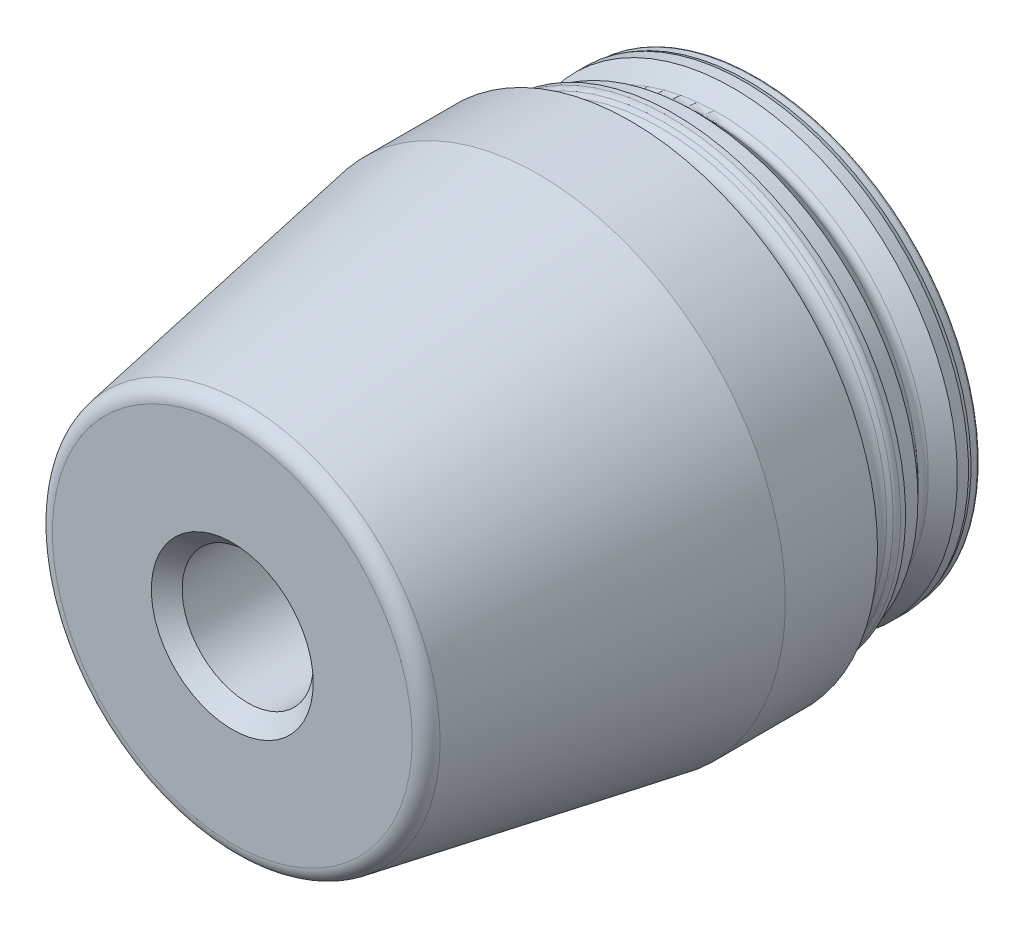
from build123d import *

# Parameters (mm, degrees)
F_5_8_11_TAPPED_HOLE1_D           = 13.49248
F_5_8_11_TAPPED_HOLE1_DEPTH       = 40.1193
F_5_8_11_TAPPED_HOLE1_CSINK_D     = 16.6624
F_5_8_11_TAPPED_HOLE1_CSINK_ANGLE = 90
F_5_8_11_TAPPED_HOLE1_TIP         = 4.053549943
FCH_00_CHAMFER_0_015_SIZE         = 0.381
FILLET1_R                         = 1.5875


with BuildPart() as part:
    # Sketch3 → FBR-00 Basic blank revolve. (revolve)
    with BuildSketch(Plane(origin=(0, 0, 0), x_dir=(0, 0, -1), z_dir=(1, 0, 0)), mode=Mode.PRIVATE) as fbr_00_basic_blank_revolve_sk:
        with BuildLine():
            Line((-45.466, 19.84375), (-45.466, 0))
            Line((-45.466, 0), (-12.115698454, 0))
            Line((-12.115698454, 0), (-7.366, 19.05))
            Line((-7.366, 19.05), (8.509, 19.05))
            Line((8.509, 19.05), (8.509, 22.6695))
            ThreePointArc((8.509, 22.6695), (8.434605122, 22.849105122), (8.255, 22.9235))
            Line((8.255, 22.9235), (7.62, 22.9235))
            Line((7.62, 22.9235), (7.239, 23.0505))
            Line((7.239, 23.0505), (6.096, 23.0505))
            Line((6.096, 23.0505), (4.602815367, 21.557315367))
            ThreePointArc((4.602815367, 21.557315367), (4.064, 21.334130735), (3.525184633, 21.557315367))
            Line((3.525184633, 21.557315367), (2.032, 23.0505))
            Line((2.032, 23.0505), (0, 23.0505))
            Line((0, 23.0505), (0, 23.8125))
            Line((0, 23.8125), (-0.508, 23.8125))
            ThreePointArc((-0.508, 23.8125), (-0.799604775, 23.754496204), (-1.046815367, 23.589315367))
            Line((-1.046815367, 23.589315367), (-1.387974388, 23.248156347))
            ThreePointArc((-1.387974388, 23.248156347), (-2.451768264, 22.887046985), (-3.385852263, 23.511181959))
            Line((-3.385852263, 23.511181959), (-4.476361867, 25.4))
            Line((-4.476361867, 25.4), (-13.95494039, 25.4))
            Line((-13.95494039, 25.4), (-45.466, 19.84375))
        make_face()
    revolve(fbr_00_basic_blank_revolve_sk.sketch.rotate(Axis((0, 0, -27.766671499), (0, 0, 1)), 90), axis=Axis((0, 0, -27.766671499), (0, 0, 1)))

    # 5/8-11 Tapped Hole1
    with Locations(Plane.XY.offset(45.466)):
        with Locations((0, 0)):
            CounterSinkHole(F_5_8_11_TAPPED_HOLE1_D / 2, F_5_8_11_TAPPED_HOLE1_CSINK_D / 2, depth=F_5_8_11_TAPPED_HOLE1_DEPTH, counter_sink_angle=F_5_8_11_TAPPED_HOLE1_CSINK_ANGLE)
            with Locations((0, 0, -(F_5_8_11_TAPPED_HOLE1_DEPTH + F_5_8_11_TAPPED_HOLE1_TIP / 2))):  # 118° drill point
                Cone(0, F_5_8_11_TAPPED_HOLE1_D / 2, F_5_8_11_TAPPED_HOLE1_TIP, mode=Mode.SUBTRACT)

    # FCH-00 Chamfer 0.015
    fch_00_chamfer_0_015_edges = [part.edges().sort_by_distance(p)[0] for p in [
        (19.05, 0, -8.509),
    ]]
    chamfer(fch_00_chamfer_0_015_edges, length=FCH_00_CHAMFER_0_015_SIZE)

    # Fillet1
    fillet1_edges = [part.edges().sort_by_distance(p)[0] for p in [
        (19.84375, 0, 45.466),
    ]]
    fillet(fillet1_edges, radius=FILLET1_R)


solid = part.part
